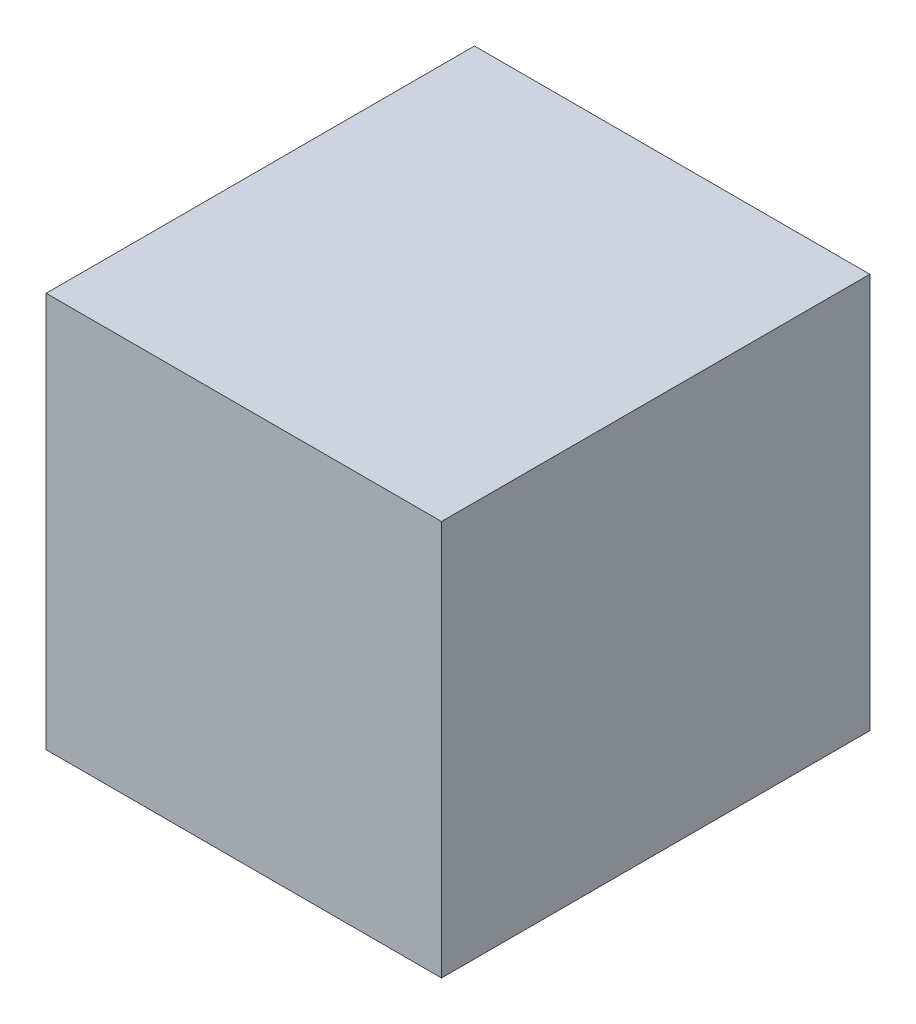
from build123d import *

# Parameters (mm, degrees)
SKETCH1_W           = 120
SKETCH1_H           = 130
BOSS_EXTRUDE1_DEPTH = 60


with BuildPart() as part:
    # Sketch1 → Boss-Extrude1 (new, symmetric)
    with BuildSketch(Plane(origin=(0, 0, 0), x_dir=(1, 0, 0), z_dir=(0, 1, 0))):
        Rectangle(SKETCH1_W, SKETCH1_H)
    extrude(amount=BOSS_EXTRUDE1_DEPTH, both=True)


solid = part.part
